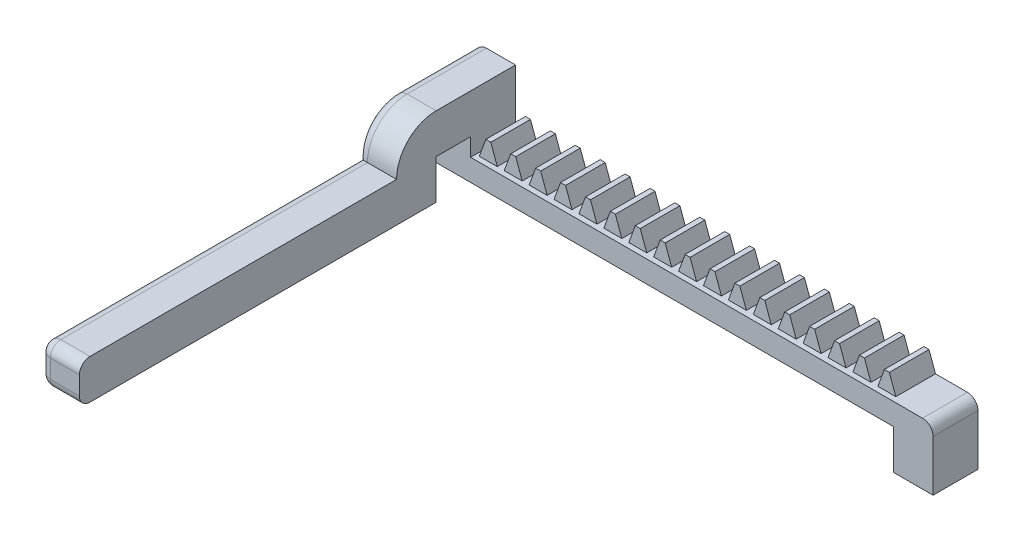
from build123d import *

# Parameters (mm, degrees)
BLANKSKE_W              = 80
BLANKSKE_H              = 7.5
BLANK_DEPTH             = 20
TOOTHCUTSIM_DEPTH       = 83.802475808
TEETHCUTS_COUNT         = 18
TEETHCUTS_PITCH         = 4.712388975
SKETCH1_W               = 20
SKETCH1_H               = 11.625
BOSS_EXTRUDE2_DEPTH     = 7.5
SKETCH3_W               = 20
SKETCH3_H               = 15
BOSS_EXTRUDE3_DEPTH     = 7.5
SKETCH4_W               = 7.5
SKETCH4_H               = 15
BOSS_EXTRUDE4_DEPTH     = 15
SKETCH8_W               = 7.5
SKETCH8_H               = 7.5
CUT_EXTRUDE1_DEPTH      = 15
CUT_EXTRUDE2_DEPTH      = 15
SKETCH10_W              = 7.5
SKETCH10_H              = 7.5
BOSS_EXTRUDE5_DEPTH     = 7.5
SKETCH11_W              = 7.5
SKETCH11_H              = 15
BOSS_EXTRUDE7_DEPTH     = 60
CUT_EXTRUDE4_DEPTH      = 116.829144109
CUT_EXTRUDE4_DEPTH_BACK = 116.829144109
SKETCH12_W              = 95
SKETCH12_H              = 10
SKETCH14_W              = 95
SKETCH14_H              = 2.5
CUT_EXTRUDE5_DEPTH      = 100
SKETCH15_W              = 67.5
SKETCH15_H              = 7.5
CUT_EXTRUDE6_DEPTH      = 122.963109177
BOSS_EXTRUDE8_START     = -7.5
BOSS_EXTRUDE8_DEPTH     = 7.5
BOSS_EXTRUDE9_DEPTH     = 1
FILLET1_R               = 2
FILLET2_R               = 2
FILLET3_R               = 2


with BuildPart() as part:
    # BlankSke → Blank (new body)
    with BuildSketch(Plane.XY):
        with Locations((40, 3.75)):
            Rectangle(BLANKSKE_W, BLANKSKE_H)
    extrude(amount=-BLANK_DEPTH)

    # TooCutSkeSim → ToothCutSim (cut, through all)
    with BuildSketch(Plane.XY):
        Polygon((0.654653055, 4.125), (-0.654653055, 4.125), (-1.892297439, 7.5254), (1.892297439, 7.5254), align=None)
    toothcutsim = extrude(amount=-TOOTHCUTSIM_DEPTH, mode=Mode.SUBTRACT)

    # TeethCuts: ToothCutSim ×18
    with Locations(*[(i * TEETHCUTS_PITCH, 0, 0) for i in range(1, TEETHCUTS_COUNT)]):
        add(toothcutsim, mode=Mode.SUBTRACT)

    # Sketch1 → Boss-Extrude2 (add)
    with BuildSketch(Plane(origin=(80, 0, 0), x_dir=(0, 0, -1), z_dir=(1, 0, 0))):
        with Locations((10, -1.6875)):
            Rectangle(SKETCH1_W, SKETCH1_H)
    extrude(amount=BOSS_EXTRUDE2_DEPTH)

    # Sketch3 → Boss-Extrude3 (add)
    with BuildSketch(Plane.ZY):
        with Locations((-10, 7.5)):
            Rectangle(SKETCH3_W, SKETCH3_H)
    extrude(amount=BOSS_EXTRUDE3_DEPTH)

    # Sketch4 → Boss-Extrude4 (add)
    with BuildSketch(Plane.XY):
        with Locations((-3.75, 7.5)):
            Rectangle(SKETCH4_W, SKETCH4_H)
    extrude(amount=BOSS_EXTRUDE4_DEPTH)

    # Sketch8 → Cut-Extrude1 (cut)
    with BuildSketch(Plane(origin=(0, 0, 0), x_dir=(0, 0, -1), z_dir=(1, 0, 0))):
        with Locations((-3.75, 3.75)):
            Rectangle(SKETCH8_W, SKETCH8_H)
    extrude(amount=-CUT_EXTRUDE1_DEPTH, mode=Mode.SUBTRACT)

    # Sketch9 → Cut-Extrude2 (cut)
    with BuildSketch(Plane.ZY.offset(7.5)):
        Polygon((7.5, 15), (15, 7.5), (15, 15), align=None)
    extrude(amount=-CUT_EXTRUDE2_DEPTH, mode=Mode.SUBTRACT)

    # Sketch10 → Boss-Extrude5 (add)
    with BuildSketch(Plane.XZ):
        with Locations((-3.75, 11.25)):
            Rectangle(SKETCH10_W, SKETCH10_H)
    extrude(amount=BOSS_EXTRUDE5_DEPTH)

    # Sketch11 → Boss-Extrude7 (add)
    with BuildSketch(Plane.XY.offset(15)):
        with Locations((-3.75, 0)):
            Rectangle(SKETCH11_W, SKETCH11_H)
    extrude(amount=BOSS_EXTRUDE7_DEPTH)

    # Sketch12 → Cut-Extrude4 (cut, two sides: drawn at the far end of the back side and taken through both)
    with BuildSketch(Plane(origin=(0, 4.125, 0), x_dir=(1, 0, 0), z_dir=(0, 1, 0)).offset(-CUT_EXTRUDE4_DEPTH_BACK)):
        with Locations((40, 15)):
            Rectangle(SKETCH12_W, SKETCH12_H)
    extrude(amount=CUT_EXTRUDE4_DEPTH + CUT_EXTRUDE4_DEPTH_BACK, mode=Mode.SUBTRACT)

    # Sketch14 → Cut-Extrude5 (cut)
    with BuildSketch(Plane(origin=(0, 15, 0), x_dir=(1, 0, 0), z_dir=(0, 1, 0))):
        with Locations((40, 8.75)):
            Rectangle(SKETCH14_W, SKETCH14_H)
    extrude(amount=-CUT_EXTRUDE5_DEPTH, mode=Mode.SUBTRACT)

    # Sketch15 → Cut-Extrude6 (cut, through all)
    with BuildSketch(Plane.ZY.offset(7.5)):
        with Locations((41.25, -3.75)):
            Rectangle(SKETCH15_W, SKETCH15_H)
    extrude(amount=-CUT_EXTRUDE6_DEPTH, mode=Mode.SUBTRACT)

    # Sketch16 → Boss-Extrude8 (add)
    with BuildSketch(Plane.ZY.offset(7.5).offset(BOSS_EXTRUDE8_START)):
        with BuildLine():
            ThreePointArc((15, 7.5), (12.803300859, 12.803300859), (7.5, 15))
            Line((7.5, 15), (15, 7.5))
        make_face()
    extrude(amount=BOSS_EXTRUDE8_DEPTH)

    # Sketch19 → Boss-Extrude9 (add)
    with BuildSketch(Plane.XY):
        Polygon((-7.5, 0), (-7.5, 7.5), (0, 7.5), (0, 4.125), (87.5, 4.125), (87.5, -7.5), (80, -7.5), (80, 0), align=None)
    extrude(amount=BOSS_EXTRUDE9_DEPTH)

    # Fillet1
    fillet1_edges = [part.edges().sort_by_distance(p)[0] for p in [
        (-7.5, 15, 0),
        (-7.5, 7.5, 45),
        (-7.5, 12.803300859, 12.803300859),
    ]]
    fillet(fillet1_edges, radius=FILLET1_R)

    # Fillet2
    fillet2_edges = [part.edges().sort_by_distance(p)[0] for p in [
        (-2.75, 7.5, 75),
        (-3.75, 0, 75),
        (-7.5, 0, 41.25),
        (-7.5, 2.75, 75),
        (-6.914213562, 6.914213562, 75),
    ]]
    fillet(fillet2_edges, radius=FILLET2_R)

    # Fillet3
    fillet3_edges = [part.edges().sort_by_distance(p)[0] for p in [
        (87.5, 4.125, -3.25),
    ]]
    fillet(fillet3_edges, radius=FILLET3_R)


solid = part.part
